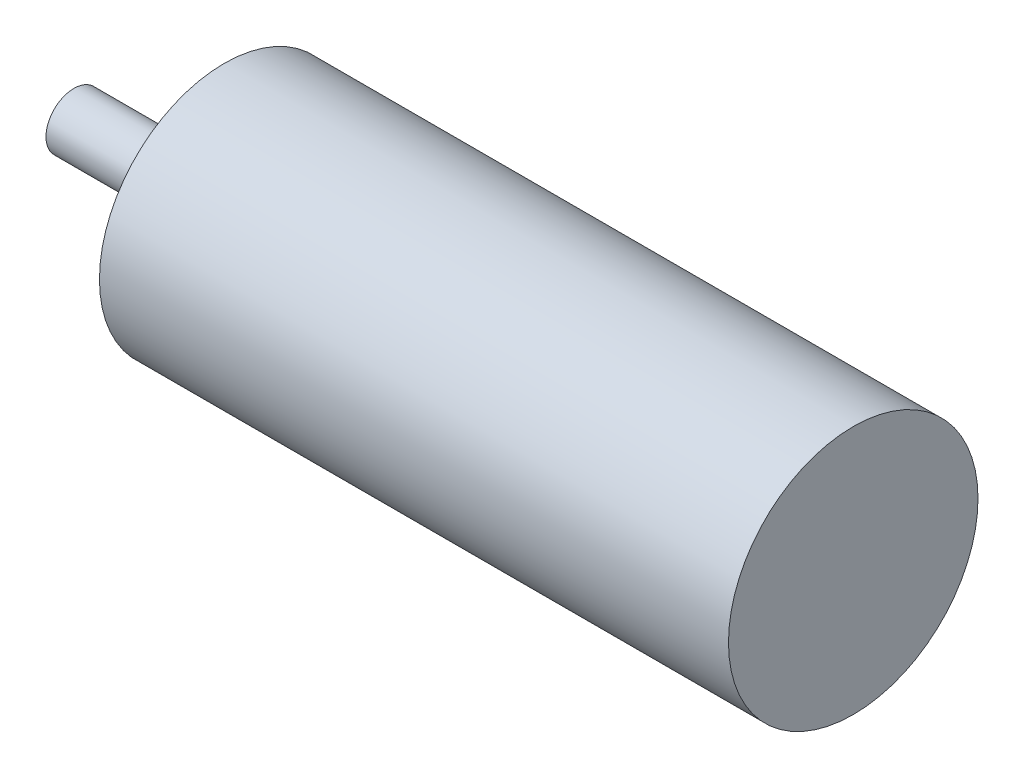
from build123d import *

# Parameters (mm, degrees)
SKETCH2_R          = 1.5
CUT_EXTRUDE1_DEPTH = 10


with BuildPart() as part:
    # Sketch1 → Revolve1 (revolve)
    with BuildSketch(Plane.XY):
        Polygon((0, 0), (0, 4), (20, 4), (20, 11), (21.5, 11), (21.5, 17.85), (111.5, 17.85), (111.5, 0), align=None)
    revolve(axis=Axis((111.5, 0, 0), (-1, 0, 0)))

    # Sketch2 → Cut-Extrude1 (cut)
    with BuildSketch(Plane.ZY.offset(-21.5)):
        with Locations(Location((0, 14, 0), (0, 0, 270))):
            Circle(SKETCH2_R)
        with Locations(Location((14, 0, 0), (0, 0, 270))):
            Circle(SKETCH2_R)
        with Locations(Location((0, -14, 0), (0, 0, 270))):
            Circle(SKETCH2_R)
        with Locations(Location((-14, 0, 0), (0, 0, 270))):
            Circle(SKETCH2_R)
    extrude(amount=-CUT_EXTRUDE1_DEPTH, mode=Mode.SUBTRACT)


solid = part.part
